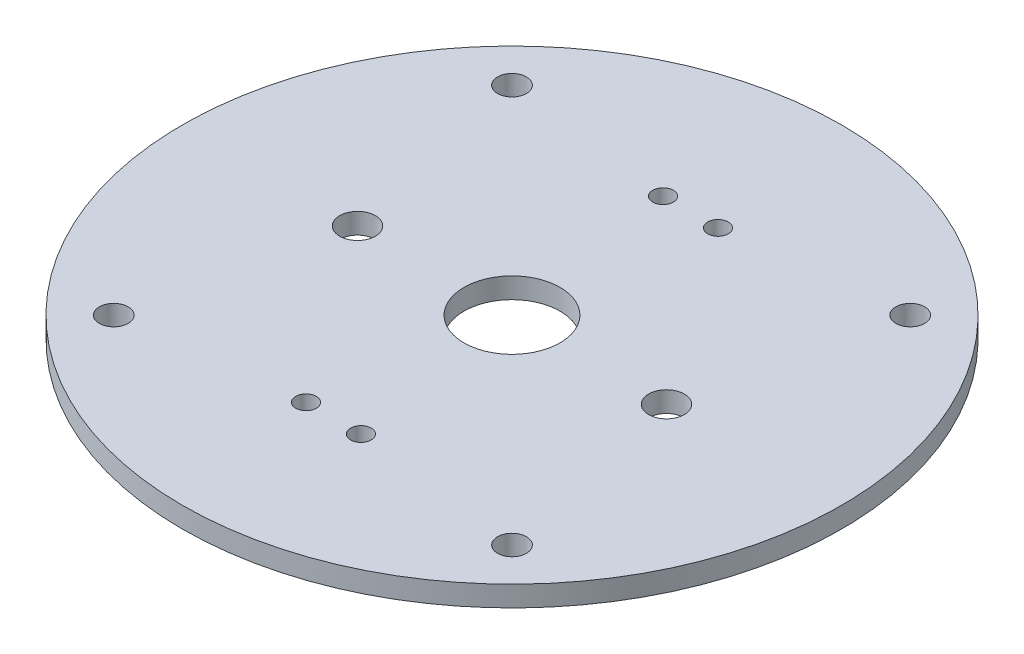
from build123d import *

# Parameters (mm, degrees)
SKETCH_1_R          = 48
SKETCH_1_R_2        = 2.1
EXTRUDE_1_DEPTH     = 3
SKETCH_2_R          = 7
SKETCH_2_R_2        = 2.6
CUT_EXTRUDE_1_DEPTH = 68.948509917
SKETCH_3_R          = 1.5
CUT_EXTRUDE_2_DEPTH = 10


with BuildPart() as part:
    # 草图1 → 凸台-拉伸1 (new body)
    with BuildSketch(Plane(origin=(0, 0, 0), x_dir=(1, 0, 0), z_dir=(0, 1, 0))):
        with Locations(Location((0, 0, 0), (0, 0, 270))):
            Circle(SKETCH_1_R)
        with Locations(Location((-29, 29, 0), (0, 0, 270))):
            Circle(SKETCH_1_R_2, mode=Mode.SUBTRACT)
        with Locations(Location((29, 29, 0), (0, 0, 270))):
            Circle(SKETCH_1_R_2, mode=Mode.SUBTRACT)
        with Locations(Location((29, -29, 0), (0, 0, 270))):
            Circle(SKETCH_1_R_2, mode=Mode.SUBTRACT)
        with Locations(Location((-29, -29, 0), (0, 0, 270))):
            Circle(SKETCH_1_R_2, mode=Mode.SUBTRACT)
    extrude(amount=EXTRUDE_1_DEPTH)

    # 草图2 → 切除-拉伸1 (cut, through all)
    with BuildSketch(Plane(origin=(0, 3, 0), x_dir=(1, 0, 0), z_dir=(0, 1, 0))):
        with Locations(Location((0, 0, 0), (0, 0, 270))):
            Circle(SKETCH_2_R)
        with Locations(Location((-22.5, 0, 0), (0, 0, 270))):
            Circle(SKETCH_2_R_2)
        with Locations(Location((22.5, 0, 0), (0, 0, 270))):
            Circle(SKETCH_2_R_2)
    extrude(amount=-CUT_EXTRUDE_1_DEPTH, mode=Mode.SUBTRACT)

    # 草图3 → 切除-拉伸2 (cut)
    with BuildSketch(Plane(origin=(0, 3, 0), x_dir=(1, 0, 0), z_dir=(0, 1, 0))):
        with Locations(Location((4, 26, 0), (0, 0, 270))):
            Circle(SKETCH_3_R)
        with Locations(Location((-4, 26, 0), (0, 0, 270))):
            Circle(SKETCH_3_R)
        with Locations(Location((-4, -26, 0), (0, 0, 270))):
            Circle(SKETCH_3_R)
        with Locations(Location((4, -26, 0), (0, 0, 270))):
            Circle(SKETCH_3_R)
    extrude(amount=-CUT_EXTRUDE_2_DEPTH, mode=Mode.SUBTRACT)


solid = part.part
